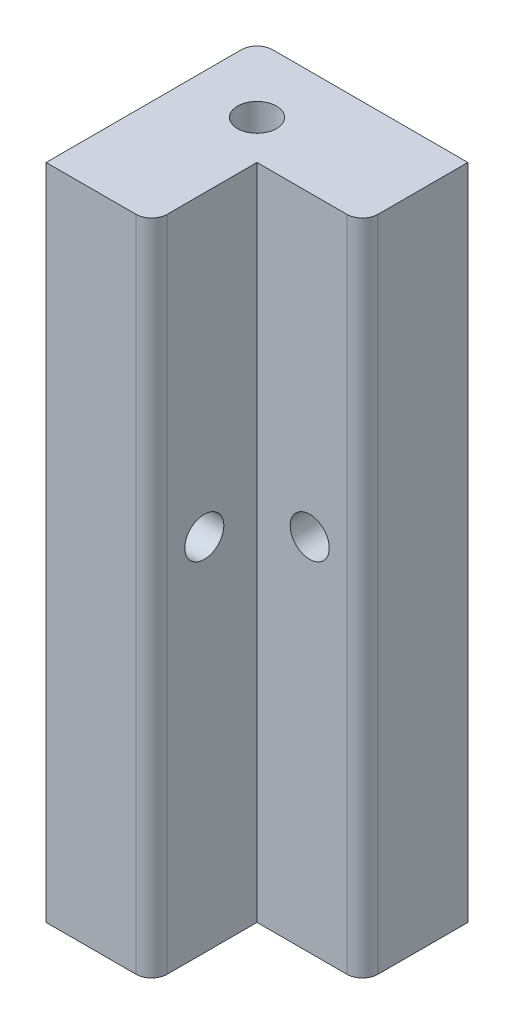
from build123d import *

# Parameters (mm, degrees)
SKETCH4_W           = 13.5
SKETCH4_H           = 13.5
SKETCH4_R           = 2.5
HOLE_TOPMAIN_DEPTH  = 64.27
SKETCH14_R          = 2.5
CUT_EXTRUDE9_DEPTH  = 67.220336
SKETCH15_R          = 3.25
CUT_EXTRUDE10_DEPTH = 66.384500568
SKETCH18_W          = 13.5
SKETCH18_H          = 64.27
SKETCH18_R          = 3.25
BOSS_EXTRUDE2_DEPTH = 13.5
FILLET3_R           = 2
SKETCH19_R          = 2.5
CUT_EXTRUDE11_DEPTH = 13.5
SKETCH22_W          = 13.5
SKETCH22_H          = 64.27
BOSS_EXTRUDE3_DEPTH = 13.5
BOSS_EXTRUDE5_START = -27
SKETCH24_R          = 3.25
BOSS_EXTRUDE5_DEPTH = 27
CUT_EXTRUDE12_START = -64.27
SKETCH25_R          = 2.5
CUT_EXTRUDE12_DEPTH = 64.27
SKETCH26_R          = 2.5
CUT_EXTRUDE13_DEPTH = 13.5
SKETCH28_R          = 2.5
CUT_EXTRUDE14_DEPTH = 13.5
FILLET4_R           = 2
SKETCH29_R          = 2.5
BOSS_EXTRUDE6_DEPTH = 20


with BuildPart() as part:
    # Sketch4 → hole-TopMain (new body)
    with BuildSketch(Plane(origin=(0, 0, 0), x_dir=(1, 0, 0), z_dir=(0, 1, 0))):
        with Locations((-1.75, 1.75)):
            Rectangle(SKETCH4_W, SKETCH4_H)
        with Locations(Location((0, 0, 0), (0, 0, 90))):
            Circle(SKETCH4_R, mode=Mode.SUBTRACT)
    extrude(amount=HOLE_TOPMAIN_DEPTH)

    # Sketch14 → Cut-Extrude9 (cut, through all)
    with BuildSketch(Plane(origin=(0, 0, -8.5), x_dir=(-1, 0, 0), z_dir=(0, 0, -1))):
        with Locations((1.75, 46.135)):
            Circle(SKETCH14_R)
    extrude(amount=-CUT_EXTRUDE9_DEPTH, mode=Mode.SUBTRACT)

    # Sketch15 → Cut-Extrude10 (cut, through all)
    with BuildSketch(Plane(origin=(0, 0, -3.5), x_dir=(-1, 0, 0), z_dir=(0, 0, -1))):
        with Locations((1.75, 46.135)):
            Circle(SKETCH15_R)
    extrude(amount=-CUT_EXTRUDE10_DEPTH, mode=Mode.SUBTRACT)

    # Sketch18 → Boss-Extrude2 (add)
    with BuildSketch(Plane.XY.offset(5)):
        with Locations((-1.75, 32.135)):
            Rectangle(SKETCH18_W, SKETCH18_H)
        with Locations(Location((-1.75, 46.135, 0), (0, 0, 180))):
            Circle(SKETCH18_R, mode=Mode.SUBTRACT)
    extrude(amount=BOSS_EXTRUDE2_DEPTH)

    # Fillet3
    fillet3_edges = [part.edges().sort_by_distance(p)[0] for p in [
        (-8.5, 32.135, -8.5),
        (5, 32.135, 18.5),
    ]]
    fillet(fillet3_edges, radius=FILLET3_R)

    # Sketch19 → Cut-Extrude11 (cut)
    with BuildSketch(Plane.ZY.offset(8.5)):
        with Locations((11.75, 46.135)):
            Circle(SKETCH19_R)
    extrude(amount=-CUT_EXTRUDE11_DEPTH, mode=Mode.SUBTRACT)

    # Sketch22 → Boss-Extrude3 (add)
    with BuildSketch(Plane(origin=(5, 0, 0), x_dir=(0, 0, -1), z_dir=(1, 0, 0))):
        with Locations((1.75, 32.135)):
            Rectangle(SKETCH22_W, SKETCH22_H)
    extrude(amount=BOSS_EXTRUDE3_DEPTH)

    # Sketch24 → Boss-Extrude5 (add)
    with BuildSketch(Plane.XY.offset(18.5).offset(BOSS_EXTRUDE5_START)):
        with Locations((-1.75, 46.135)):
            Circle(SKETCH24_R)
    extrude(amount=BOSS_EXTRUDE5_DEPTH)

    # Sketch25 → Cut-Extrude12 (cut)
    with BuildSketch(Plane(origin=(0, 64.27, 0), x_dir=(1, 0, 0), z_dir=(0, 1, 0)).offset(CUT_EXTRUDE12_START)):
        with Locations(Location((0, 0, 0), (0, 0, 90))):
            Circle(SKETCH25_R)
    extrude(amount=CUT_EXTRUDE12_DEPTH, mode=Mode.SUBTRACT)

    # Sketch26 → Cut-Extrude13 (cut)
    with BuildSketch(Plane.ZY.offset(8.5)):
        with Locations((11.75, 46.135)):
            Circle(SKETCH26_R)
    extrude(amount=-CUT_EXTRUDE13_DEPTH, mode=Mode.SUBTRACT)

    # Sketch28 → Cut-Extrude14 (cut)
    with BuildSketch(Plane(origin=(0, 0, -8.5), x_dir=(-1, 0, 0), z_dir=(0, 0, -1))):
        with Locations((-11.75, 46.135)):
            Circle(SKETCH28_R)
    extrude(amount=-CUT_EXTRUDE14_DEPTH, mode=Mode.SUBTRACT)

    # Fillet4
    fillet4_edges = [part.edges().sort_by_distance(p)[0] for p in [
        (18.5, 32.135, 5),
    ]]
    fillet(fillet4_edges, radius=FILLET4_R)

    # Sketch29 → Boss-Extrude6 (add)
    with BuildSketch(Plane(origin=(0, 64.27, 0), x_dir=(1, 0, 0), z_dir=(0, 1, 0))):
        with BuildLine():
            Line((5, -16.5), (5, -5))
            Line((5, -5), (16.5, -5))
            ThreePointArc((16.5, -5), (17.914213562, -4.414213562), (18.5, -3))
            Line((18.5, -3), (18.5, 8.5))
            Line((18.5, 8.5), (-6.5, 8.5))
            ThreePointArc((-6.5, 8.5), (-7.914213562, 7.914213562), (-8.5, 6.5))
            Line((-8.5, 6.5), (-8.5, -18.5))
            Line((-8.5, -18.5), (3, -18.5))
            ThreePointArc((3, -18.5), (4.414213562, -17.914213562), (5, -16.5))
        make_face()
        with Locations(Location((0, 0, 0), (0, 0, 90))):
            Circle(SKETCH29_R, mode=Mode.SUBTRACT)
    extrude(amount=BOSS_EXTRUDE6_DEPTH)


solid = part.part
